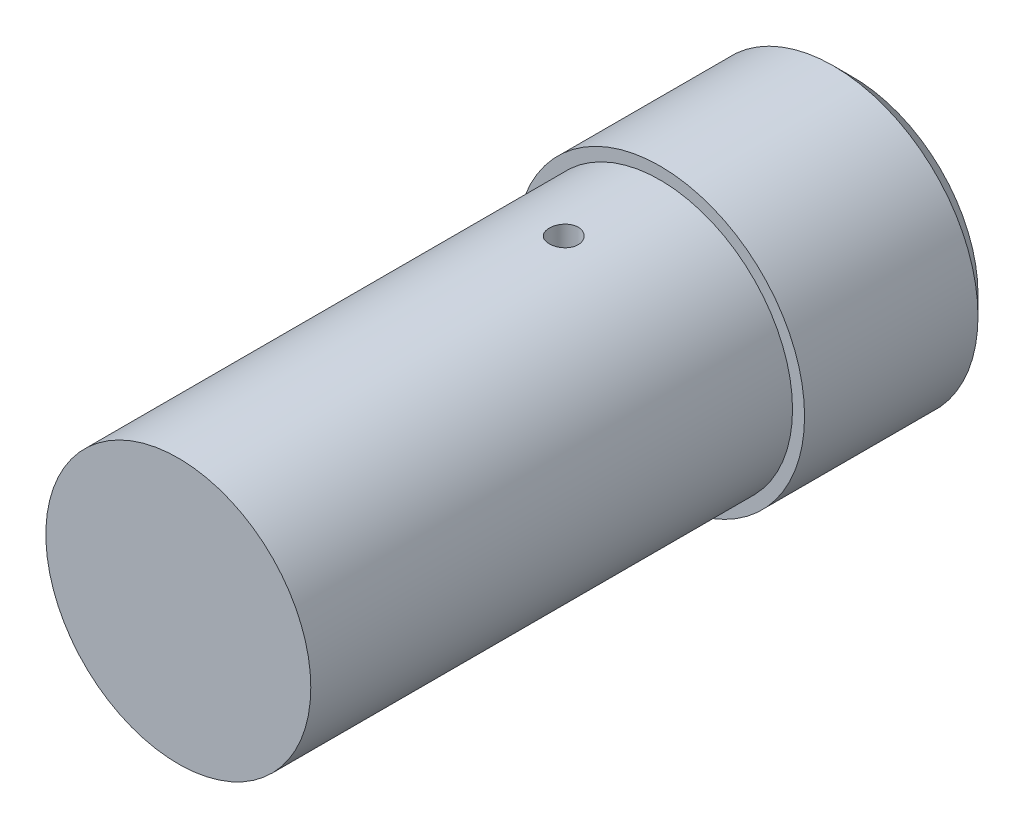
from build123d import *

# Parameters (mm, degrees)
ESQUISSE1_R             = 30
BASE_EXTRUSION_DEPTH    = 40
ESQUISSE2_R             = 27.5
BOSS_EXTRU_1_DEPTH      = 100
ESQUISSE3_R             = 3
ENL_V_MAT_EXTRU_1_DEPTH = 30
CHANFREIN1_SIZE         = 4


with BuildPart() as part:
    # Esquisse1 → Base-Extrusion (new body)
    with BuildSketch(Plane.XY):
        Circle(ESQUISSE1_R)
    extrude(amount=BASE_EXTRUSION_DEPTH)

    # Esquisse2 → Boss.-Extru.1 (add)
    with BuildSketch(Plane.XY.offset(40)):
        Circle(ESQUISSE2_R)
    extrude(amount=BOSS_EXTRU_1_DEPTH)

    # Esquisse3 → Enlèv. mat.-Extru.1 (cut)
    with BuildSketch(Plane(origin=(0, 30, 0), x_dir=(-1, 0, 0), z_dir=(0, 1, 0))):
        with Locations(Location((0, 60, 0), (0, 0, 90))):
            Circle(ESQUISSE3_R)
    extrude(amount=-ENL_V_MAT_EXTRU_1_DEPTH, mode=Mode.SUBTRACT)

    # Chanfrein1
    chanfrein1_edges = [part.edges().sort_by_distance(p)[0] for p in [
        (-30, 0, 0),
    ]]
    chamfer(chanfrein1_edges, length=CHANFREIN1_SIZE)


solid = part.part
